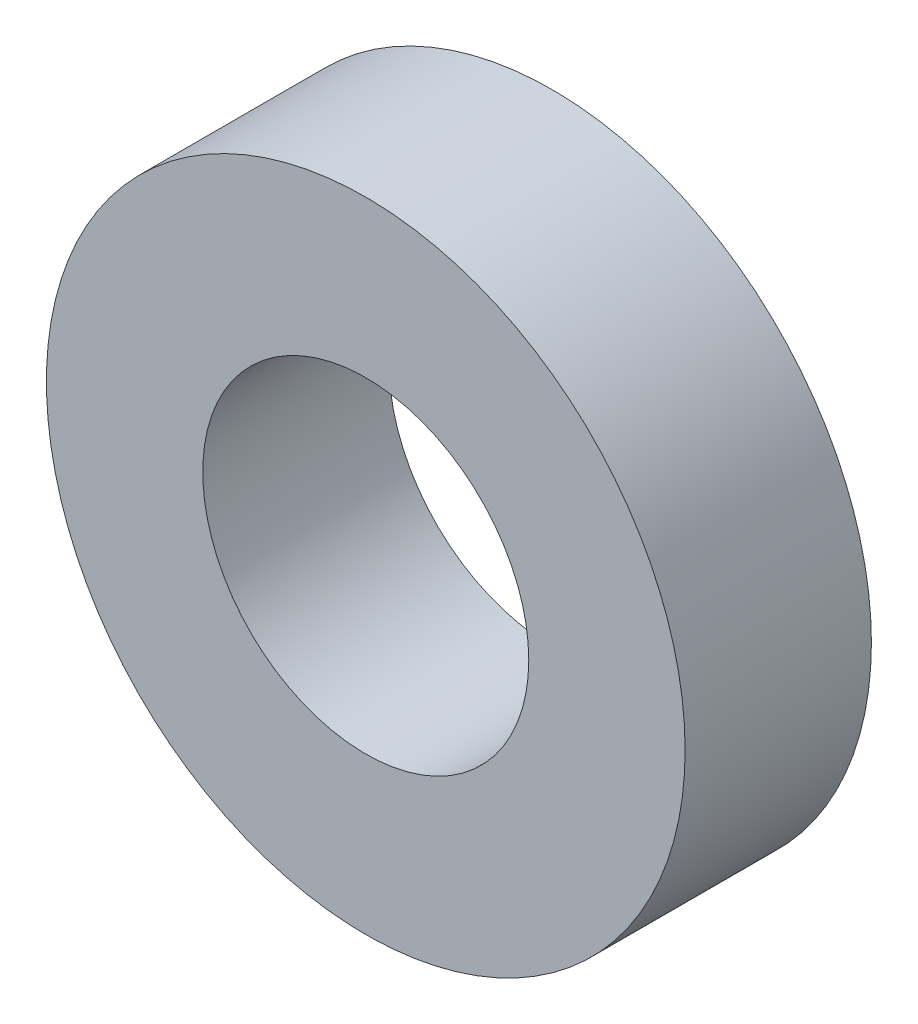
from build123d import *

# Parameters (mm, degrees)
SKETCH1_R           = 12
SKETCH1_R_2         = 6.125
BOSS_EXTRUDE1_DEPTH = 7


with BuildPart() as part:
    # Sketch1 → Boss-Extrude1 (new body)
    with BuildSketch(Plane.XY):
        Circle(SKETCH1_R)
        Circle(SKETCH1_R_2, mode=Mode.SUBTRACT)
    extrude(amount=BOSS_EXTRUDE1_DEPTH)


solid = part.part
